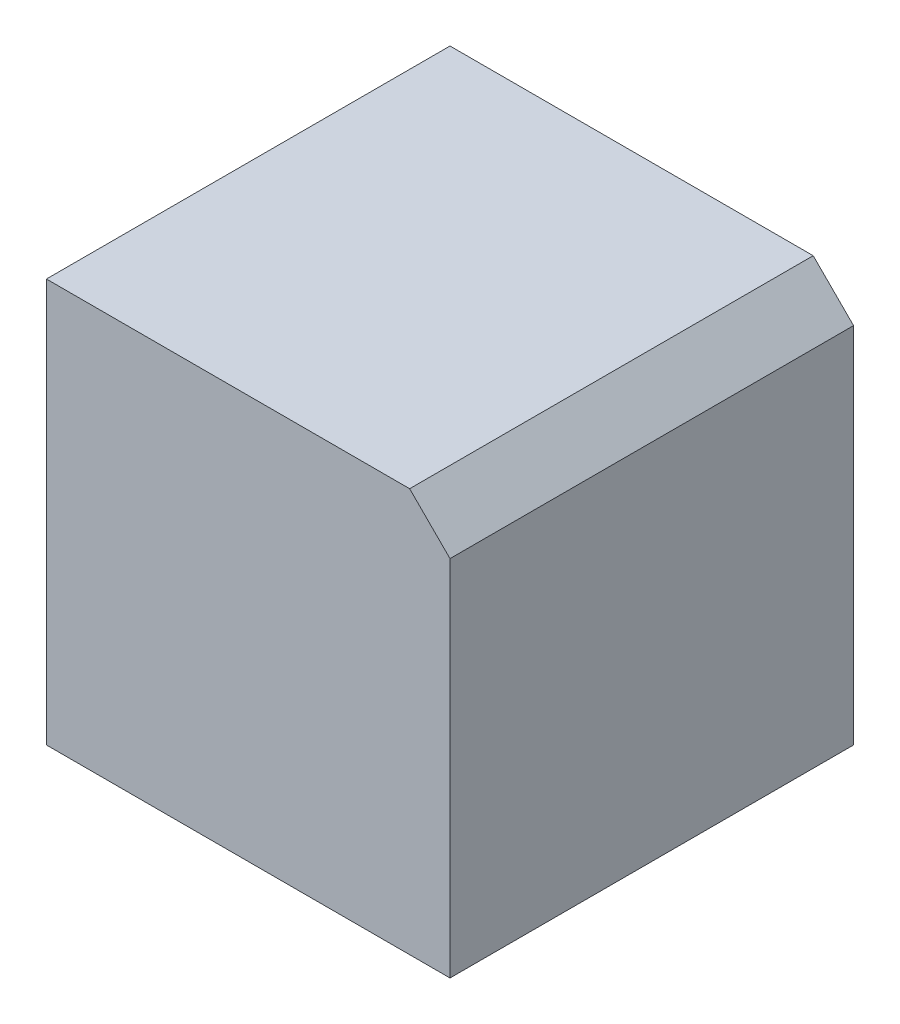
from build123d import *

# Parameters (mm, degrees)
SKETCH1_W           = 10
SKETCH1_H           = 10
BOSS_EXTRUDE1_DEPTH = 10
CHAMFER1_SIZE       = 1


with BuildPart() as part:
    # Sketch1 → Boss-Extrude1 (new body)
    with BuildSketch(Plane.XY):
        with Locations((5, 5)):
            Rectangle(SKETCH1_W, SKETCH1_H)
    extrude(amount=BOSS_EXTRUDE1_DEPTH)

    # Chamfer1
    chamfer1_edges = [part.edges().sort_by_distance(p)[0] for p in [
        (10, 10, 5),
    ]]
    chamfer(chamfer1_edges, length=CHAMFER1_SIZE)


solid = part.part
